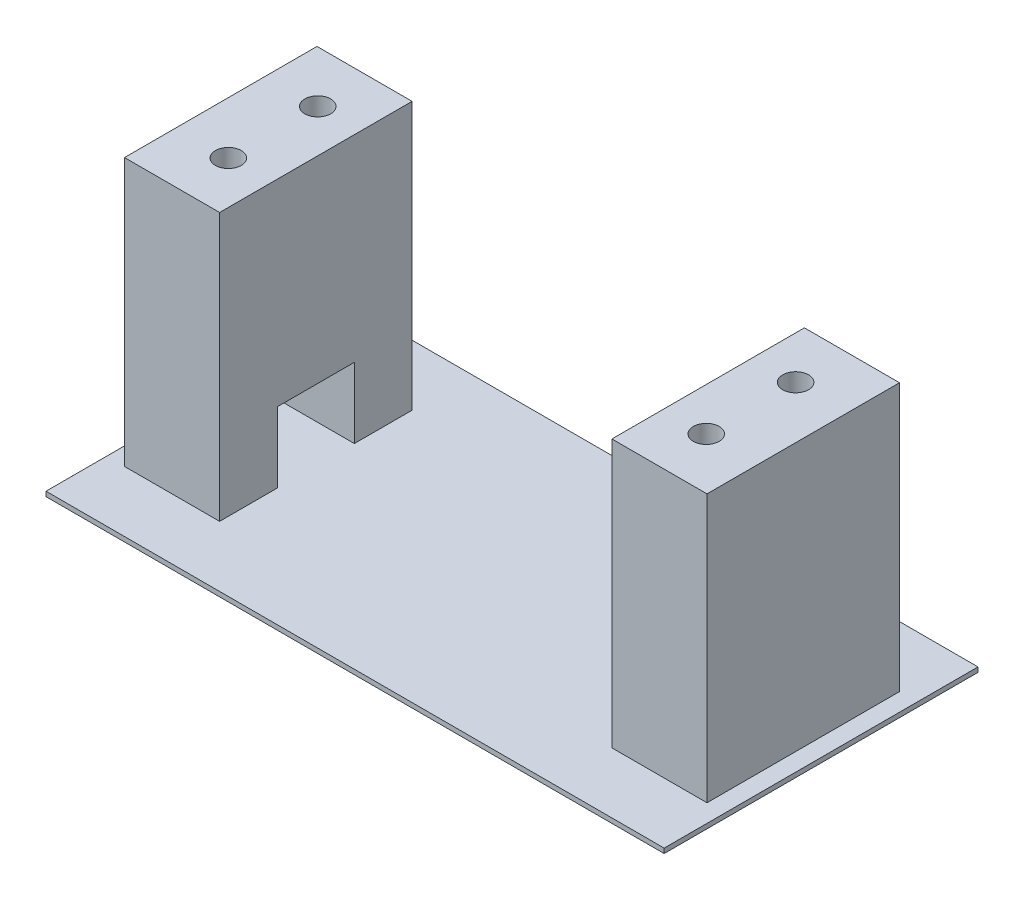
from build123d import *

# Parameters (mm, degrees)
SKETCH1_W           = 65
SKETCH1_H           = 33
BOSS_EXTRUDE1_DEPTH = 0.5
SKETCH2_W           = 10
SKETCH2_H           = 20.24
BOSS_EXTRUDE2_DEPTH = 28.13
CUT_EXTRUDE1_START  = -10
SKETCH3_R           = 1.361077795
CUT_EXTRUDE1_DEPTH  = 57.348429315
CUT_EXTRUDE2_REACH  = 73.251
SKETCH4_W           = 8.1
SKETCH4_H           = 7.4


with BuildPart() as part:
    # Sketch1 → Boss-Extrude1 (new body)
    with BuildSketch(Plane(origin=(0, 0, 0), x_dir=(1, 0, 0), z_dir=(0, 1, 0))):
        Rectangle(SKETCH1_W, SKETCH1_H)
    extrude(amount=BOSS_EXTRUDE1_DEPTH)

    # Sketch2 → Boss-Extrude2 (add)
    with BuildSketch(Plane(origin=(0, 0.5, 0), x_dir=(1, 0, 0), z_dir=(0, 1, 0))):
        with Locations((25.625, 0)):
            Rectangle(SKETCH2_W, SKETCH2_H)
    boss_extrude2 = extrude(amount=BOSS_EXTRUDE2_DEPTH)

    # Sketch3 → Cut-Extrude1 (cut)
    with BuildSketch(Plane(origin=(0, 28.63, 0), x_dir=(1, 0, 0), z_dir=(0, 1, 0)).offset(CUT_EXTRUDE1_START)):
        with Locations(Location((25.125, 4.7, 0), (0, 0, 90))):
            Circle(SKETCH3_R)
        with Locations(Location((25.125, -4.7, 0), (0, 0, 90))):
            Circle(SKETCH3_R)
    cut_extrude1 = extrude(amount=CUT_EXTRUDE1_DEPTH, mode=Mode.SUBTRACT)

    # Mirror3: Boss-Extrude2, Cut-Extrude1 across plane
    add(boss_extrude2.mirror(Plane(origin=(0, 0, 0), x_dir=(0, 0, 1), z_dir=(1, 0, 0))))
    add(cut_extrude1.mirror(Plane(origin=(0, 0, 0), x_dir=(0, 0, 1), z_dir=(1, 0, 0))), mode=Mode.SUBTRACT)

    # Sketch4 → Cut-Extrude2 (cut, up to next)
    with BuildSketch(Plane.ZY.offset(30.625), mode=Mode.PRIVATE) as cut_extrude2_sk1:
        with Locations((0, 4.2)):
            Rectangle(SKETCH4_W, SKETCH4_H)
    cut_extrude2_tool1 = extrude(cut_extrude2_sk1.sketch, amount=-CUT_EXTRUDE2_REACH, mode=Mode.PRIVATE) & part.part
    add(cut_extrude2_tool1.solids().sort_by_distance((-30.625, 4.2, 0))[0], mode=Mode.SUBTRACT)


solid = part.part
